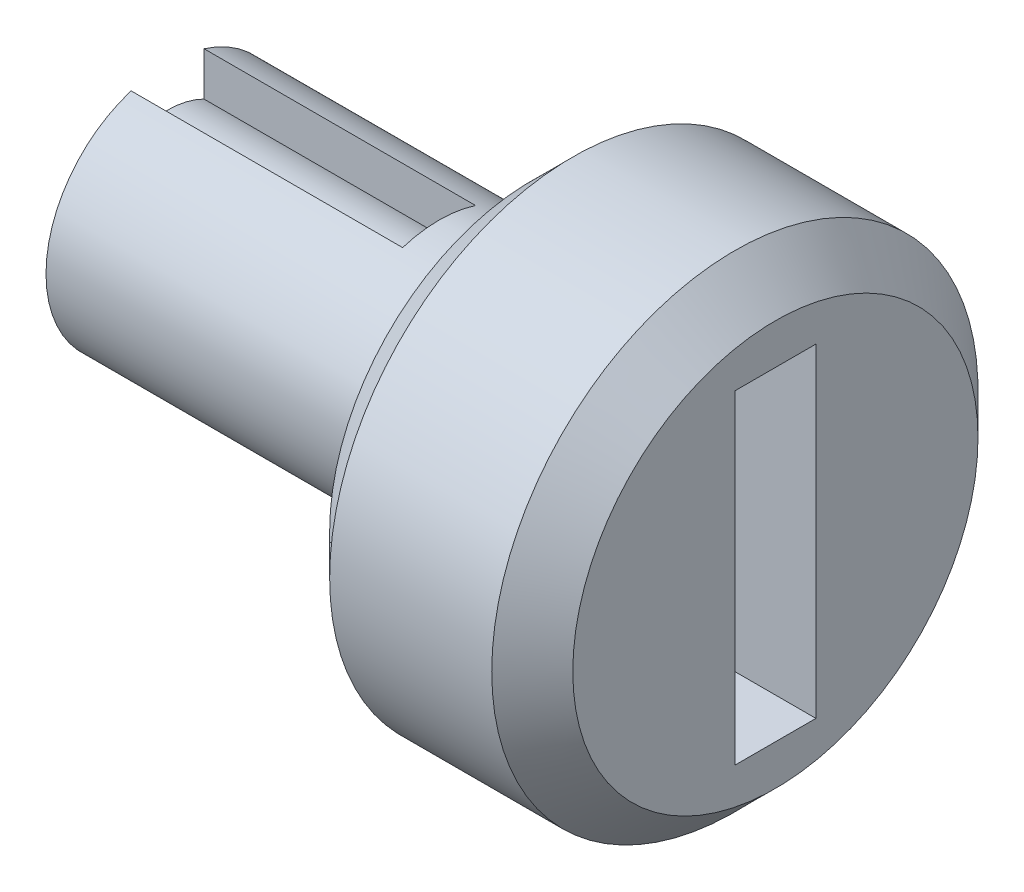
from build123d import *

# Parameters (mm, degrees)
SKETCH3_R          = 1.2
CUT_EXTRUDE1_DEPTH = 9
SKETCH4_W          = 2
SKETCH4_H          = 8
CUT_EXTRUDE2_DEPTH = 4
CHAMFER1_SIZE      = 1
CUT_EXTRUDE3_START = -6.7
CUT_EXTRUDE3_DEPTH = 6.7


with BuildPart() as part:
    # Sketch2 → Revolve1 (revolve)
    with BuildSketch(Plane(origin=(0, 0, 0), x_dir=(1, 0, 0), z_dir=(0, 1, 0)), mode=Mode.PRIVATE) as revolve1_sk:
        Polygon((0, 0), (0, 3), (9, 3), (9, 6), (15, 6), (15, 0), align=None)
    revolve(revolve1_sk.sketch.rotate(Axis((0, 0, 0), (1, 0, 0)), 180), axis=Axis((0, 0, 0), (1, 0, 0)))

    # Sketch3 → Cut-Extrude1 (cut)
    with BuildSketch(Plane.ZY):
        Circle(SKETCH3_R)
    extrude(amount=-CUT_EXTRUDE1_DEPTH, mode=Mode.SUBTRACT)

    # Sketch4 → Cut-Extrude2 (cut)
    with BuildSketch(Plane(origin=(15, 0, 0), x_dir=(0, 0, -1), z_dir=(1, 0, 0))):
        Rectangle(SKETCH4_W, SKETCH4_H)
    extrude(amount=-CUT_EXTRUDE2_DEPTH, mode=Mode.SUBTRACT)

    # Chamfer1
    chamfer1_edges = [part.edges().sort_by_distance(p)[0] for p in [
        (15, 0, -6),
        (9, 0, -6),
    ]]
    chamfer(chamfer1_edges, length=CHAMFER1_SIZE)

    # Sketch5 → Cut-Extrude3 (cut)
    with BuildSketch(Plane.ZY.offset(CUT_EXTRUDE3_START)):
        with BuildLine():
            Line((-0.9, 2.861817604), (-0.9, 1.78605711))
            ThreePointArc((-0.9, 1.78605711), (0, 2), (0.9, 1.78605711))
            Line((0.9, 1.78605711), (0.9, 2.861817604))
            ThreePointArc((0.9, 2.861817604), (0, 3), (-0.9, 2.861817604))
        make_face()
        with BuildLine():
            Line((-0.9, -1.78605711), (-0.9, -2.861817604))
            ThreePointArc((-0.9, -2.861817604), (0, -3), (0.9, -2.861817604))
            Line((0.9, -2.861817604), (0.9, -1.78605711))
            ThreePointArc((0.9, -1.78605711), (0, -2), (-0.9, -1.78605711))
        make_face()
    extrude(amount=CUT_EXTRUDE3_DEPTH, mode=Mode.SUBTRACT)


solid = part.part
